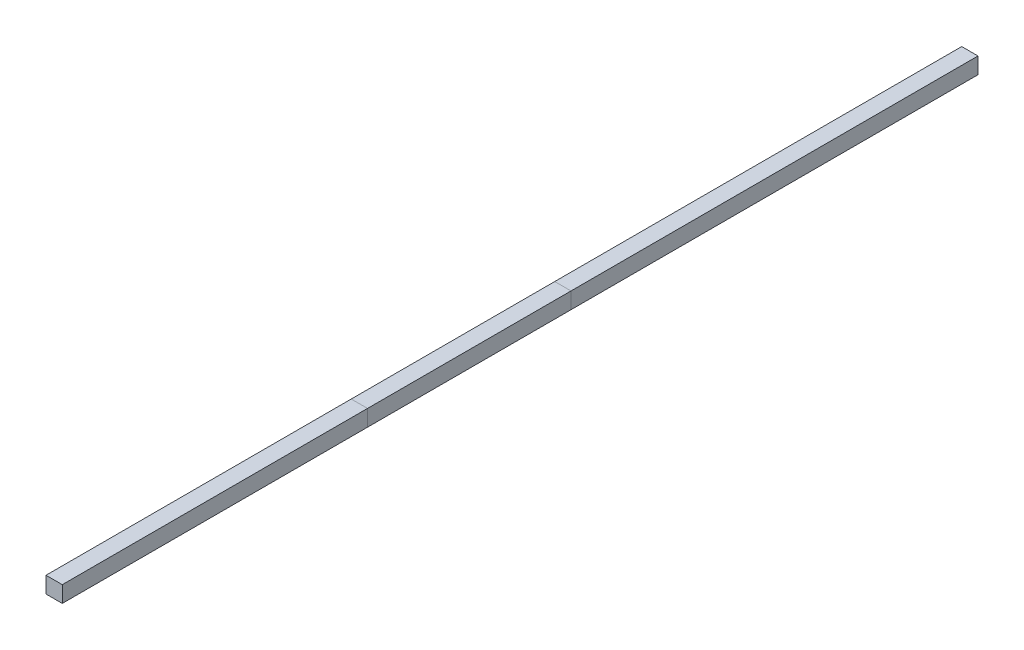
from build123d import *

# Parameters (mm, degrees)
SZKIC1_W                     = 80
SZKIC1_H                     = 80
DODANIE_WYCI_GNI_CIE8_DEPTH  = 2000
DODANIE_WYCI_GNI_CIE9_START  = 2000
SZKIC1_12_W                  = 80
SZKIC1_12_H                  = 80
DODANIE_WYCI_GNI_CIE9_DEPTH  = 1000
DODANIE_WYCI_GNI_CIE10_START = 3000
SZKIC1_13_W                  = 80
SZKIC1_13_H                  = 80
DODANIE_WYCI_GNI_CIE10_DEPTH = 1500


with BuildPart() as part:
    # Szkic1 → Dodanie-wyciągnięcie8 (new body)
    with BuildSketch(Plane.XY):
        with Locations((40, 40)):
            Rectangle(SZKIC1_W, SZKIC1_H)
    extrude(amount=DODANIE_WYCI_GNI_CIE8_DEPTH)


with BuildPart() as body_2:
    # Szkic1<12> → Dodanie-wyciągnięcie9 (new body)
    with BuildSketch(Plane.XY.offset(DODANIE_WYCI_GNI_CIE9_START)):
        with Locations((40, 40)):
            Rectangle(SZKIC1_12_W, SZKIC1_12_H)
    extrude(amount=DODANIE_WYCI_GNI_CIE9_DEPTH)


with BuildPart() as body_3:
    # Szkic1<13> → Dodanie-wyciągnięcie10 (new body)
    with BuildSketch(Plane.XY.offset(DODANIE_WYCI_GNI_CIE10_START)):
        with Locations((40, 40)):
            Rectangle(SZKIC1_13_W, SZKIC1_13_H)
    extrude(amount=DODANIE_WYCI_GNI_CIE10_DEPTH)


solid = Compound([part.part, body_2.part, body_3.part])
